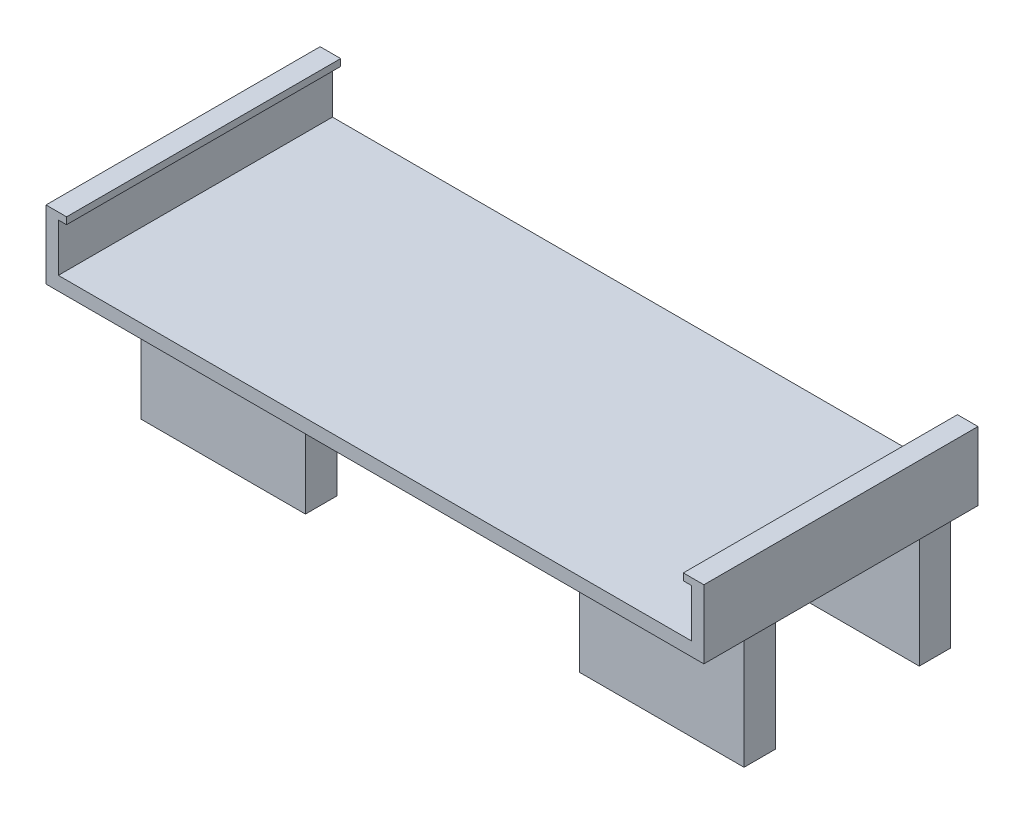
from build123d import *

# Parameters (mm, degrees)
SKETCH_1_W          = 48
SKETCH_1_H          = 20
EXTRUDE_1_DEPTH     = 5
CUT_EXTRUDE_1_DEPTH = 33.234273685
SKETCH_3_W          = 12
SKETCH_3_H          = 15.07
EXTRUDE_2_DEPTH     = 10
SKETCH_4_W          = 10.5
SKETCH_4_H          = 8
CUT_EXTRUDE_2_DEPTH = 50.294132697


with BuildPart() as part:
    # 草图1 → 凸台-拉伸1 (new body)
    with BuildSketch(Plane(origin=(0, 0, 0), x_dir=(1, 0, 0), z_dir=(0, 1, 0))):
        with Locations((-0.78, 4.625714286)):
            Rectangle(SKETCH_1_W, SKETCH_1_H)
    extrude(amount=EXTRUDE_1_DEPTH)

    # 草图2 → 切除-拉伸1 (cut, through all)
    with BuildSketch(Plane.XY.offset(5.374285714)):
        Polygon((-23.28, 5), (-23.28, 4.5), (-23.88, 4.5), (-23.88, 1), (22.32, 1), (22.32, 4.5), (21.72, 4.5), (21.72, 5), align=None)
    extrude(amount=-CUT_EXTRUDE_1_DEPTH, mode=Mode.SUBTRACT)

    # 草图3 → 凸台-拉伸2 (add)
    with BuildSketch(Plane.XZ):
        with Locations((-16.78, -7.090714286)):
            Rectangle(SKETCH_3_W, SKETCH_3_H)
        with Locations((15.22, -7.090714286)):
            Rectangle(SKETCH_3_W, SKETCH_3_H)
    extrude(amount=EXTRUDE_2_DEPTH)

    # 草图4 → 切除-拉伸2 (cut, through all)
    with BuildSketch(Plane(origin=(21.22, 0, 0), x_dir=(0, 0, -1), z_dir=(1, 0, 0))):
        with Locations((7.090714286, -6)):
            Rectangle(SKETCH_4_W, SKETCH_4_H)
    extrude(amount=-CUT_EXTRUDE_2_DEPTH, mode=Mode.SUBTRACT)


solid = part.part
